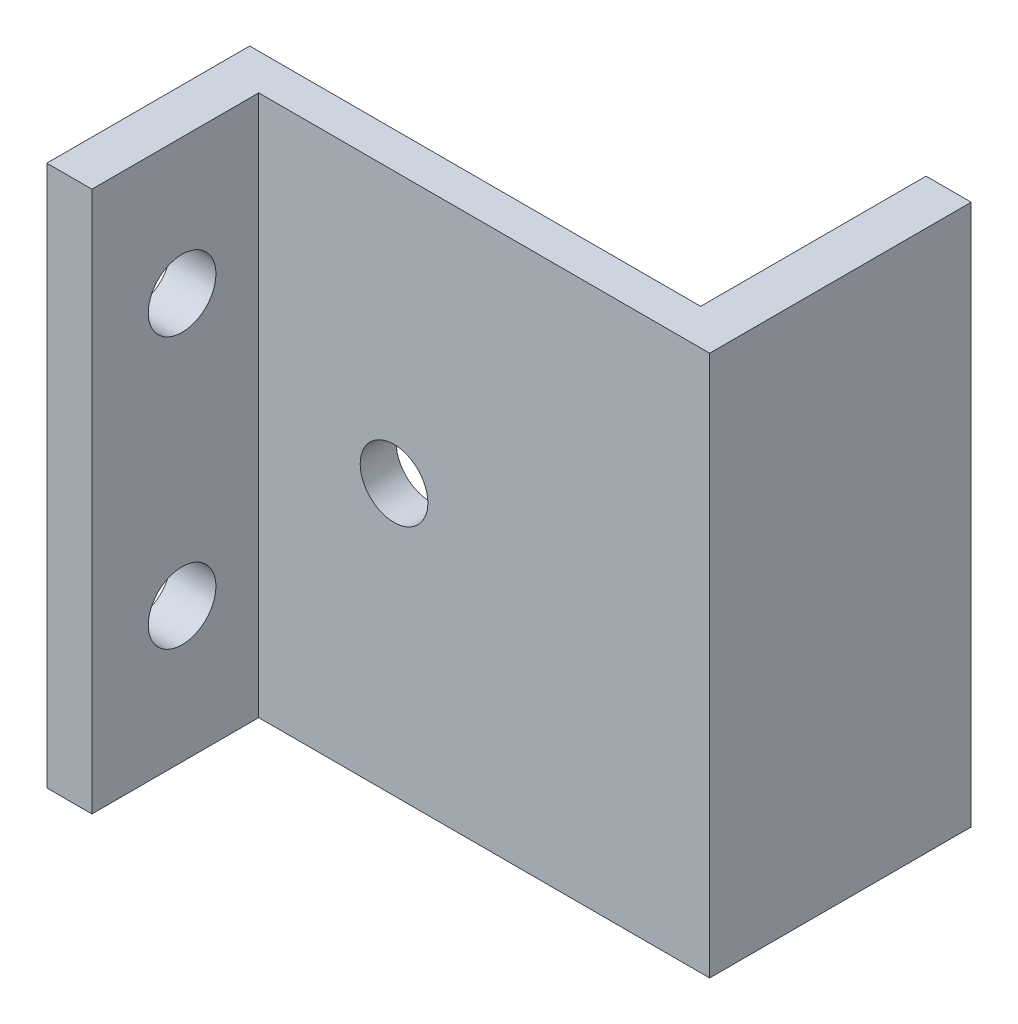
from build123d import *

# Parameters (mm, degrees)
RESSALTO_EXTRUS_O2_DEPTH = 24
ESBO_O2_R                = 1.5
CORTE_EXTRUS_O1_DEPTH    = 24
ESBO_O6_R                = 1.5
CORTE_EXTRUS_O2_DEPTH    = 13


with BuildPart() as part:
    # Esboço1 → Ressalto-extrusão2 (new body)
    with BuildSketch(Plane(origin=(0, 0, 0), x_dir=(1, 0, 0), z_dir=(0, 1, 0))):
        Polygon((0, 0), (0, -7.4), (2, -7.4), (2, 0), (22, 0), (22, 11.6), (20, 11.6), (20, 1.6), (0, 1.6), align=None)
    extrude(amount=RESSALTO_EXTRUS_O2_DEPTH)

    # Esboço2 → Corte-extrusão1 (cut)
    with BuildSketch(Plane.ZY):
        with Locations((3.4, 18)):
            Circle(ESBO_O2_R)
        with Locations((3.4, 6)):
            Circle(ESBO_O2_R)
    extrude(amount=-CORTE_EXTRUS_O1_DEPTH, mode=Mode.SUBTRACT)

    # Esboço6 → Corte-extrusão2 (cut)
    with BuildSketch(Plane(origin=(0, 0, -1.6), x_dir=(-1, 0, 0), z_dir=(0, 0, -1))):
        with Locations((-8, 12)):
            Circle(ESBO_O6_R)
    extrude(amount=-CORTE_EXTRUS_O2_DEPTH, mode=Mode.SUBTRACT)


solid = part.part
